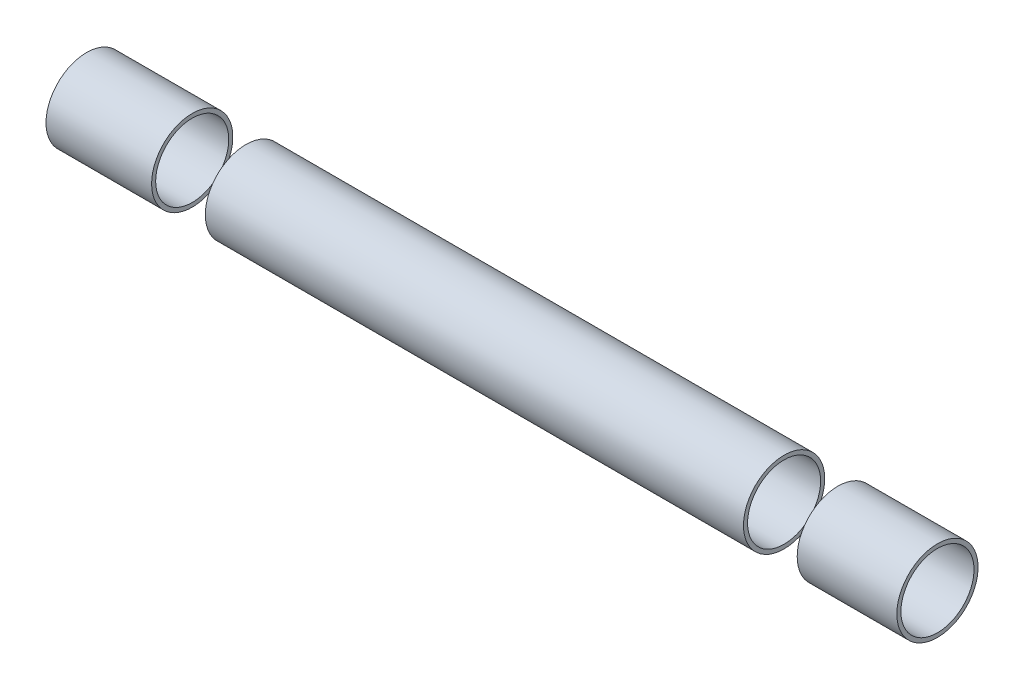
from build123d import *

# Parameters (mm, degrees)
SKETCH1_R               = 15.875
SKETCH1_R_2             = 14.2875
EXTRUDE_THIN1_DEPTH     = 167.4495
CUT_EXTRUDE1_DEPTH      = 169.947821236
CUT_EXTRUDE1_DEPTH_BACK = 169.947821236
SKETCH2_W               = 20.99999991
SKETCH2_H               = 31.75
SKETCH2_W_2             = 2.3241


with BuildPart() as part:
    # Sketch1 → Extrude-Thin1 (new, symmetric)
    with BuildSketch(Plane(origin=(0, 0, 0), x_dir=(0, 0, -1), z_dir=(1, 0, 0))):
        Circle(SKETCH1_R)
        Circle(SKETCH1_R_2, mode=Mode.SUBTRACT)
    extrude(amount=EXTRUDE_THIN1_DEPTH, both=True)

    # Sketch2 → Cut-Extrude1 (cut, two sides: drawn at the far end of the back side and taken through both)
    with BuildSketch(Plane.XY.offset(-CUT_EXTRUDE1_DEPTH_BACK)):
        with Locations((115.674500045, 0)):
            Rectangle(SKETCH2_W, SKETCH2_H)
        with Locations((-115.674500045, 0)):
            Rectangle(SKETCH2_W, SKETCH2_H)
        with Locations((166.28745, 0)):
            Rectangle(SKETCH2_W_2, SKETCH2_H)
    extrude(amount=CUT_EXTRUDE1_DEPTH + CUT_EXTRUDE1_DEPTH_BACK, mode=Mode.SUBTRACT)


with BuildPart() as cut_extrude1_piece_1:
    # of the separate pieces the step leaves, piece 1, a body of its own (cut_extrude1_pieces)
    add(part.part.solids().sort_by_distance((-105.17450009, 0, -15.875))[0])


with BuildPart() as cut_extrude1_piece_2:
    # of the separate pieces the step leaves, piece 2, a body of its own (cut_extrude1_pieces)
    add(part.part.solids().sort_by_distance((-167.4495, 0, -15.875))[0])


with BuildPart() as cut_extrude1_piece_3:
    # of the separate pieces the step leaves, piece 3, a body of its own (cut_extrude1_pieces)
    add(part.part.solids().sort_by_distance((126.1745, 0, -15.875))[0])


solid = Compound([cut_extrude1_piece_1.part, cut_extrude1_piece_2.part, cut_extrude1_piece_3.part])
